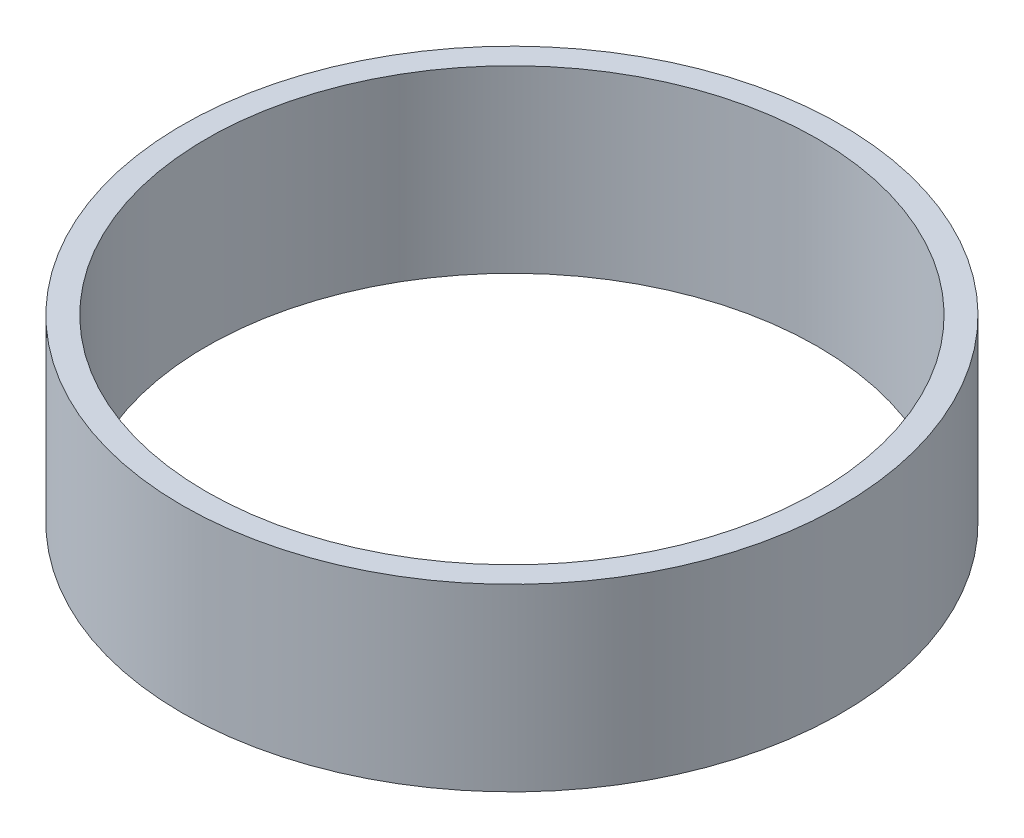
from build123d import *

# Parameters (mm, degrees)
SKETCH1_R           = 11
SKETCH1_R_2         = 10.2
BOSS_EXTRUDE1_DEPTH = 6


with BuildPart() as part:
    # Sketch1 → Boss-Extrude1 (new body)
    with BuildSketch(Plane(origin=(0, 0, 0), x_dir=(1, 0, 0), z_dir=(0, 1, 0))):
        with Locations(Location((0, 0, 0), (0, 0, 270))):
            Circle(SKETCH1_R)
        with Locations(Location((0, 0, 0), (0, 0, 270))):
            Circle(SKETCH1_R_2, mode=Mode.SUBTRACT)
    extrude(amount=BOSS_EXTRUDE1_DEPTH)


solid = part.part
